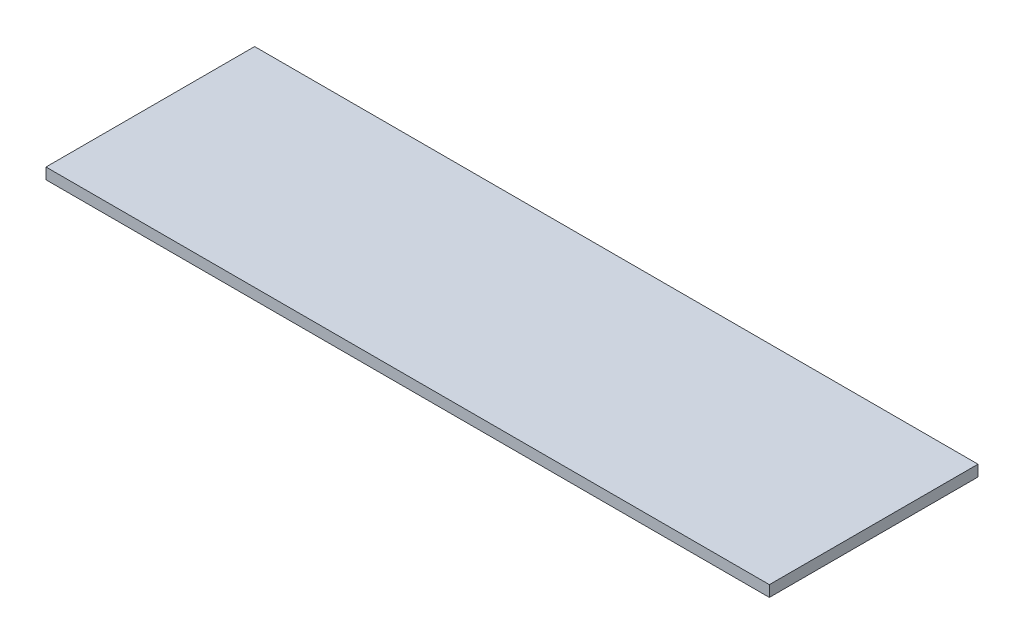
from build123d import *

# Parameters (mm, degrees)
SKETCH1_W           = 293
SKETCH1_H           = 84.5
BOSS_EXTRUDE1_DEPTH = 4.5


with BuildPart() as part:
    # Sketch1 → Boss-Extrude1 (new body)
    with BuildSketch(Plane(origin=(0, 0, 0), x_dir=(1, 0, 0), z_dir=(0, 1, 0))):
        Rectangle(SKETCH1_W, SKETCH1_H)
    extrude(amount=BOSS_EXTRUDE1_DEPTH)


solid = part.part
